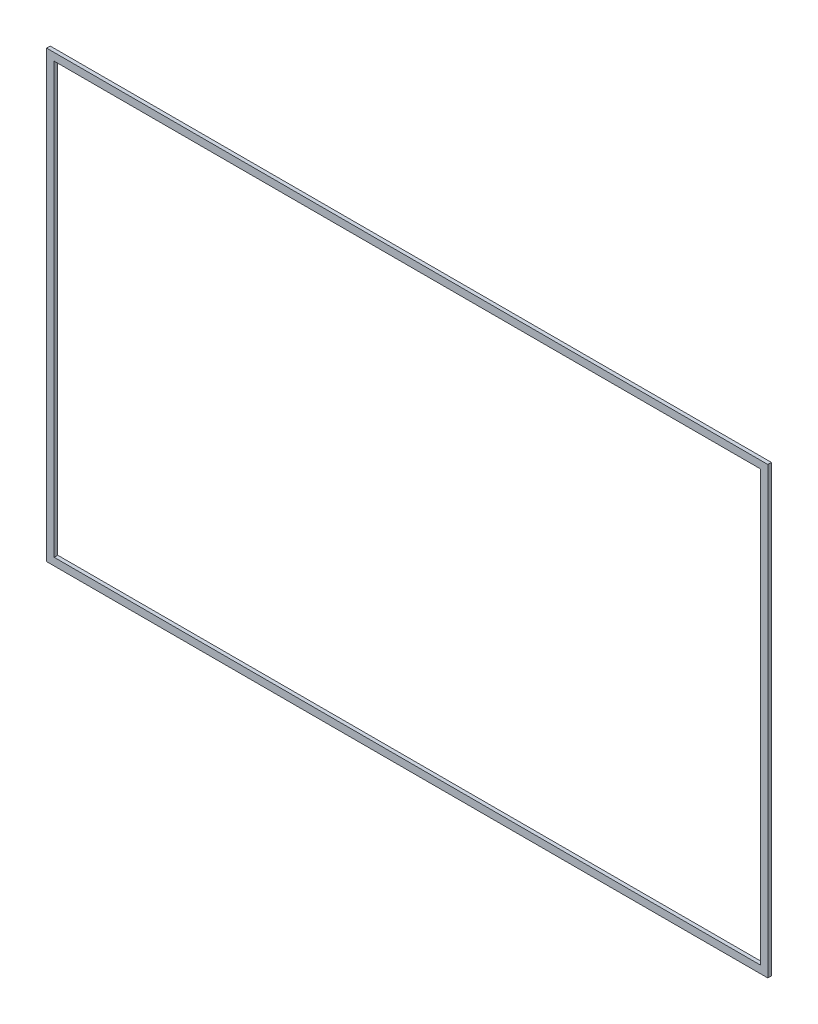
from build123d import *

# Parameters (mm, degrees)
SKETCH1_W           = 240
SKETCH1_H           = 148
SKETCH1_W_2         = 235
SKETCH1_H_2         = 143
BOSS_EXTRUDE1_DEPTH = 1.2


with BuildPart() as part:
    # Sketch1 → Boss-Extrude1 (new body)
    with BuildSketch(Plane.XY):
        Rectangle(SKETCH1_W, SKETCH1_H)
        Rectangle(SKETCH1_W_2, SKETCH1_H_2, mode=Mode.SUBTRACT)
    extrude(amount=-BOSS_EXTRUDE1_DEPTH)


solid = part.part
